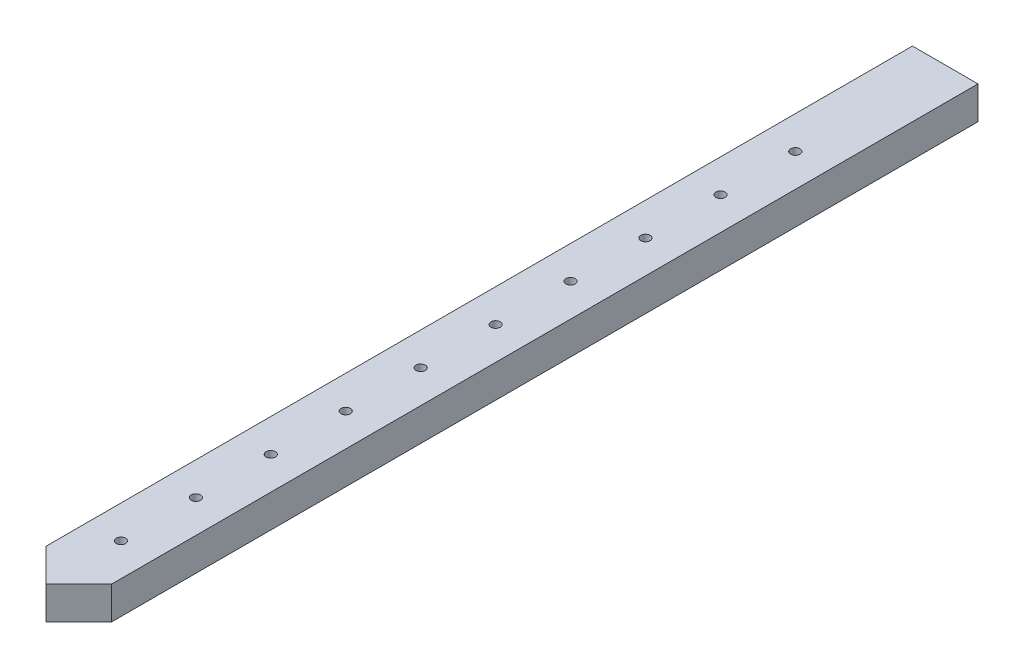
from build123d import *

# Parameters (mm, degrees)
SKETCH1_W           = 88.9
SKETCH1_H           = 44.45
BOSS_EXTRUDE1_DEPTH = 1219.2
CUT_EXTRUDE1_DEPTH  = 1221.819497305
SKETCH3_R           = 6.35
CUT_EXTRUDE2_DEPTH  = 22.225
LPATTERN1_COUNT     = 10
LPATTERN1_PITCH     = 101.6


with BuildPart() as part:
    # Sketch1 → Boss-Extrude1 (new body)
    with BuildSketch(Plane.XY):
        Rectangle(SKETCH1_W, SKETCH1_H)
    extrude(amount=BOSS_EXTRUDE1_DEPTH)

    # Sketch2 → Cut-Extrude1 (cut, through all)
    with BuildSketch(Plane(origin=(0, 22.225, 0), x_dir=(1, 0, 0), z_dir=(0, 1, 0))):
        Polygon((-44.45, -1219.2), (0, -1219.2), (-44.45, -1174.75), align=None)
        Polygon((44.45, -1174.75), (0, -1219.2), (44.45, -1219.2), align=None)
    extrude(amount=-CUT_EXTRUDE1_DEPTH, mode=Mode.SUBTRACT)

    # Sketch3 → Cut-Extrude2 (cut)
    with BuildSketch(Plane(origin=(0, 22.225, 0), x_dir=(1, 0, 0), z_dir=(0, 1, 0))):
        with Locations(Location((0, -1117.6, 0), (0, 0, 270))):
            Circle(SKETCH3_R)
    cut_extrude2 = extrude(amount=-CUT_EXTRUDE2_DEPTH, mode=Mode.SUBTRACT)

    # LPattern1: Cut-Extrude2 ×10
    with Locations(*[(0, 0, -i * LPATTERN1_PITCH) for i in range(1, LPATTERN1_COUNT)]):
        add(cut_extrude2, mode=Mode.SUBTRACT)


solid = part.part
